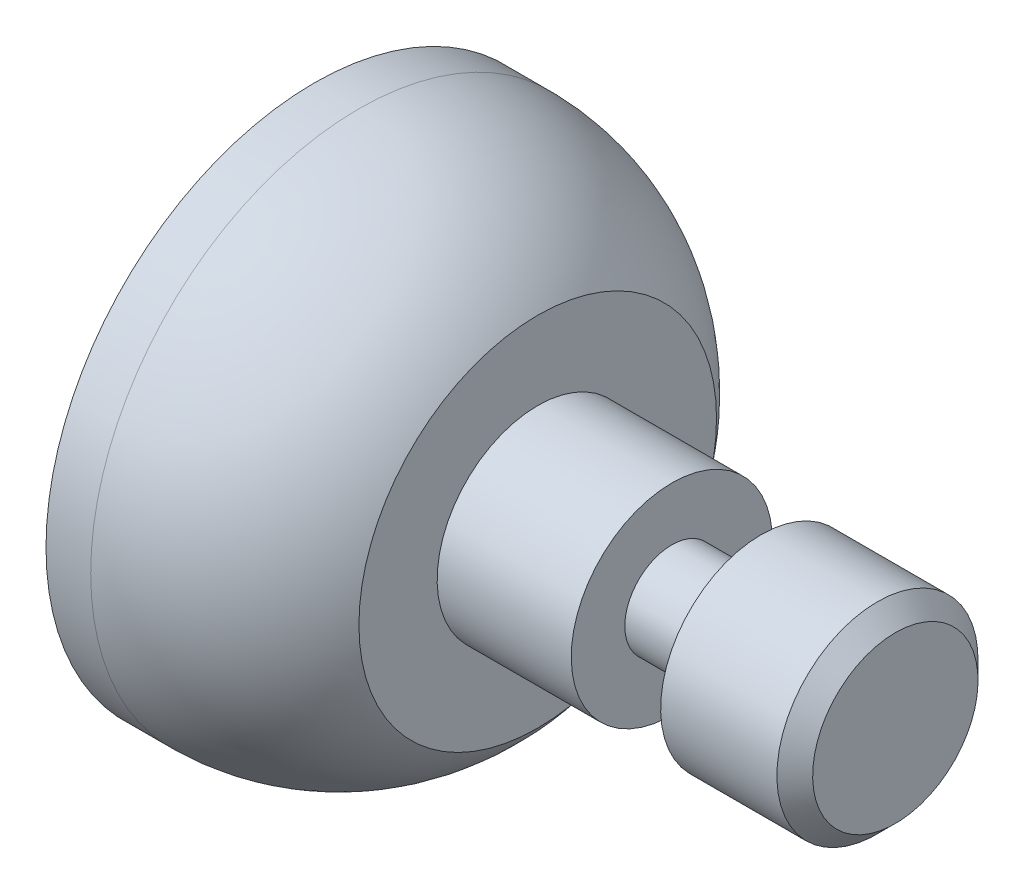
from build123d import *

# Parameters (mm, degrees)
CHAMFER1_SIZE = 1.27


with BuildPart() as part:
    # Sketch1 → Revolve1 (revolve)
    with BuildSketch(Plane.XY):
        with BuildLine():
            Line((0, 0), (0, 19.05))
            Line((0, 19.05), (3.175, 19.05))
            ThreePointArc((3.175, 19.05), (10.274515829, 17.374031657), (15.875, 12.7))
            Line((15.875, 12.7), (15.875, 7.14375))
            Line((15.875, 7.14375), (25.4, 7.14375))
            Line((25.4, 7.14375), (25.4, 3.3401))
            Line((25.4, 3.3401), (31.75, 3.3401))
            Line((31.75, 3.3401), (31.75, 7.14375))
            Line((31.75, 7.14375), (41.275, 7.14375))
            Line((41.275, 7.14375), (41.275, 0))
            Line((41.275, 0), (0, 0))
        make_face()
    revolve(axis=Axis((41.275, 0, 0), (-1, 0, 0)))

    # Chamfer1
    chamfer1_edges = [part.edges().sort_by_distance(p)[0] for p in [
        (41.275, -7.14375, 0),
    ]]
    chamfer(chamfer1_edges, length=CHAMFER1_SIZE)


solid = part.part
